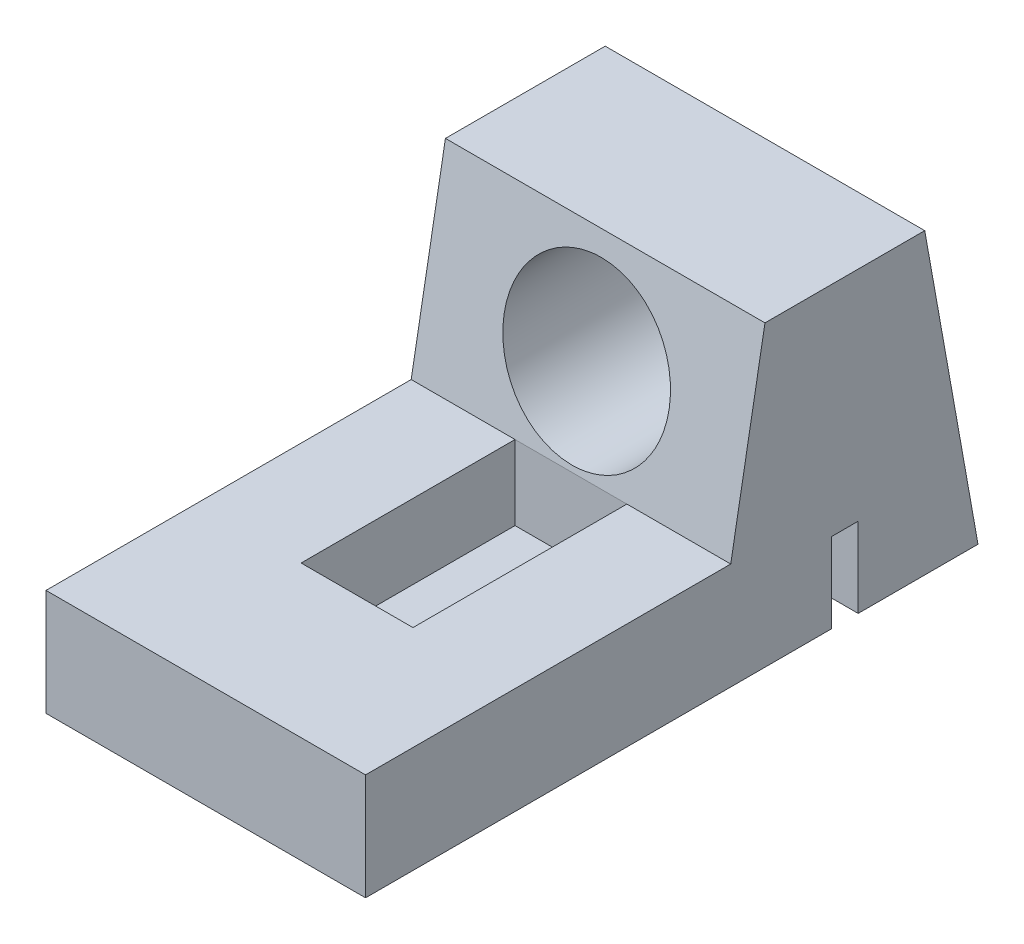
from build123d import *

# Parameters (mm, degrees)
EXTRUDE_1_DEPTH          = 60
CUT_EXTRUDE_1_DEPTH      = 40
CUT_EXTRUDE_1_DEPTH_BACK = 29
SKETCH_4_R               = 15.5
SKETCH_5_W               = 5
SKETCH_5_H               = 30
CUT_EXTRUDE_2_DEPTH      = 83.900874001
SKETCH_7_W               = 60
SKETCH_7_H               = 85.424918669
EXTRUDE_2_DEPTH          = 20
CUT_EXTRUDE_START        = -31.454396
SKETCH_9_W               = 21
SKETCH_9_H               = 40.17
CUT_EXTRUDE_3_DEPTH      = 14


with BuildPart() as part:
    # 스케치3 → 보스-돌출1 (new body)
    with BuildSketch(Plane(origin=(0, 0, 0), x_dir=(0, 0, -1), z_dir=(1, 0, 0))):
        Polygon((-25, -51.454396413), (25, -51.454396413), (15, 4.545603587), (-15, 4.545603587), align=None)
    extrude(amount=EXTRUDE_1_DEPTH)

    # 스케치4 → 컷-돌출1 (cut, two sides: drawn at the far end of the back side and taken through both)
    with BuildSketch(Plane.XY.offset(-CUT_EXTRUDE_1_DEPTH_BACK)):
        with Locations(Location((30, -14.954396413, 0), (0, 0, 90))):
            Circle(SKETCH_4_R)
    extrude(amount=CUT_EXTRUDE_1_DEPTH + CUT_EXTRUDE_1_DEPTH_BACK, mode=Mode.SUBTRACT)

    # 스케치5 → 컷-돌출2 (cut, through all)
    with BuildSketch(Plane(origin=(0, 0, 0), x_dir=(0, 0, -1), z_dir=(1, 0, 0))):
        with Locations((0, -51.454396413)):
            Rectangle(SKETCH_5_W, SKETCH_5_H)
    extrude(amount=CUT_EXTRUDE_2_DEPTH, mode=Mode.SUBTRACT)

    # 스케치7 → 보스-돌출2 (add)
    with BuildSketch(Plane(origin=(0, -51.454396413, 0), x_dir=(-1, 0, 0), z_dir=(0, -1, 0))):
        with Locations((-30, -47.287540666)):
            Rectangle(SKETCH_7_W, SKETCH_7_H)
    extrude(amount=-EXTRUDE_2_DEPTH)

    # 스케치9 → 컷-돌출3 (cut)
    with BuildSketch(Plane(origin=(0, 0, 0), x_dir=(1, 0, 0), z_dir=(0, 1, 0)).offset(CUT_EXTRUDE_START)):
        with Locations((30, -41.513571429)):
            Rectangle(SKETCH_9_W, SKETCH_9_H)
    extrude(amount=-CUT_EXTRUDE_3_DEPTH, mode=Mode.SUBTRACT)


solid = part.part
